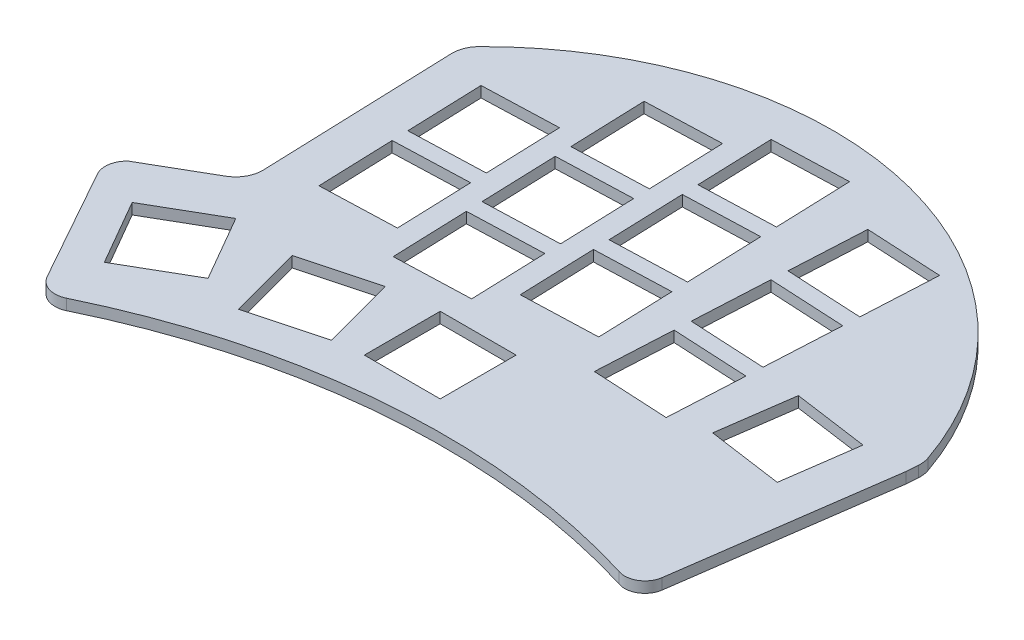
from build123d import *

# Parameters (mm, degrees)
SKETCH2_W           = 14
SKETCH2_H           = 14.003492138
BOSS_EXTRUDE1_DEPTH = 2


with BuildPart() as part:
    # Sketch2 → Boss-Extrude1 (new body)
    with BuildSketch(Plane(origin=(0, 0, 0), x_dir=(1, 0, 0), z_dir=(0, 1, 0))):
        with BuildLine():
            Line((-1095.769577908, -1082.63934327), (-1107.541983277, -1061.584764794))
            ThreePointArc((-1107.541983277, -1061.584764794), (-1108.000297721, -1058.999800443), (-1106.757289889, -1056.687437072))
            Line((-1106.757289889, -1056.687437072), (-1095.359092699, -1050.106684856))
            ThreePointArc((-1095.359092699, -1050.106684856), (-1093.52896568, -1048.276557838), (-1092.859092699, -1045.776557838))
            Line((-1092.859092699, -1045.776557838), (-1094.115480669, -1009.711041726))
            ThreePointArc((-1094.115480669, -1009.711041726), (-1093.777019534, -1007.720622139), (-1092.679112618, -1006.026241285))
            ThreePointArc((-1092.679112618, -1006.026241285), (-1032.311467942, -988.369881675), (-985.507730543, -1030.38666075))
            ThreePointArc((-985.507730543, -1030.38666075), (-985.278073332, -1031.364982485), (-985.24860148, -1032.369466065))
            Line((-985.24860148, -1032.369466065), (-985.404903488, -1034.555701493))
            Line((-985.404903488, -1034.555701493), (-990.945620353, -1073.979950898))
            ThreePointArc((-990.945620353, -1073.979950898), (-992.753308552, -1076.67957505), (-995.991887306, -1076.939026078))
            ThreePointArc((-995.991887306, -1076.939026078), (-1043.957441778, -1071.676478665), (-1090.53391343, -1084.286835898))
            ThreePointArc((-1090.53391343, -1084.286835898), (-1093.478902478, -1084.502780598), (-1095.769577908, -1082.63934327))
        make_face()
        Polygon((-1086.294602377, -1012.058273794), (-1072.303130777, -1011.569680794), (-1071.814676576, -1025.557177729), (-1085.806148176, -1026.045770729), align=None, mode=Mode.SUBTRACT)
        Polygon((-1068.720871477, -999.537331894), (-1068.232278477, -1013.528803494), (-1054.244579364, -1013.040342232), (-1054.733172364, -999.048870632), align=None, mode=Mode.SUBTRACT)
        Polygon((-1050.906333977, -993.912186894), (-1036.914862377, -993.423593894), (-1036.426243752, -1007.415799297), (-1050.417715352, -1007.904392297), align=None, mode=Mode.SUBTRACT)
        Polygon((-1027.613440377, -999.372618594), (-1013.632626977, -1000.105321994), (-1014.36558899, -1014.091070024), (-1028.34640239, -1013.358366624), align=None, mode=Mode.SUBTRACT)
        Polygon((-1028.503151677, -1016.349320694), (-1014.522338277, -1017.082024094), (-1015.25503736, -1031.062755126), (-1029.23585076, -1030.330051726), align=None, mode=Mode.SUBTRACT)
        Polygon((-1029.392862977, -1033.326022794), (-1015.412049577, -1034.058726194), (-1016.144804819, -1048.04052879), (-1030.125618219, -1047.30782539), align=None, mode=Mode.SUBTRACT)
        Polygon((-1007.457654877, -1032.332416694), (-993.593901877, -1034.280840094), (-995.542405578, -1048.145164464), (-1009.406158578, -1046.196741064), align=None, mode=Mode.SUBTRACT)
        Polygon((-1050.313042577, -1010.901830994), (-1036.321570977, -1010.413237994), (-1035.832862611, -1024.408013247), (-1049.824334211, -1024.896606247), align=None, mode=Mode.SUBTRACT)
        Polygon((-1068.127580077, -1016.526975994), (-1054.136108477, -1016.038382994), (-1053.647579498, -1030.028021263), (-1067.639051098, -1030.516614263), align=None, mode=Mode.SUBTRACT)
        Polygon((-1067.534288677, -1033.516620094), (-1053.542817077, -1033.028027094), (-1053.054129332, -1047.022211839), (-1067.045600932, -1047.510804839), align=None, mode=Mode.SUBTRACT)
        Polygon((-1085.701310977, -1029.047917894), (-1071.709839377, -1028.559324894), (-1071.22126078, -1042.550384043), (-1085.21273238, -1043.038977043), align=None, mode=Mode.SUBTRACT)
        Polygon((-1049.719751177, -1027.891475094), (-1035.728279577, -1027.402882094), (-1035.239810651, -1041.390800691), (-1049.231282251, -1041.879393691), align=None, mode=Mode.SUBTRACT)
        with Locations((-1046.973178577, -1058.907162363)):
            Rectangle(SKETCH2_W, SKETCH2_H, mode=Mode.SUBTRACT)
        Polygon((-1076.546392677, -1056.655668794), (-1063.023431077, -1053.032202194), (-1059.399339813, -1066.557495071), (-1072.922301413, -1070.180961671), align=None, mode=Mode.SUBTRACT)
        Polygon((-1099.786325567, -1062.934815358), (-1092.78632559, -1075.059170971), (-1080.661053874, -1068.058642082), (-1087.661053851, -1055.934286468), align=None, mode=Mode.SUBTRACT)
    extrude(amount=BOSS_EXTRUDE1_DEPTH)


solid = part.part
